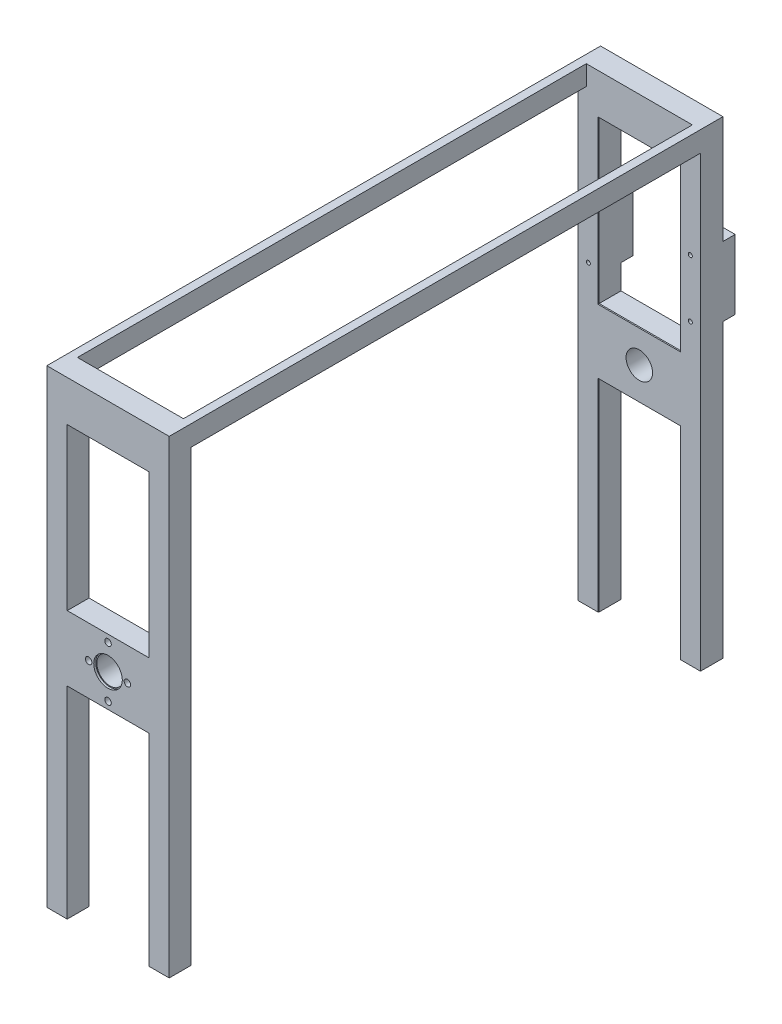
from build123d import *

# Parameters (mm, degrees)
BOSS_EXTRUDE1_START      = -8
SKETCH1_W                = 60
SKETCH1_H                = 230
BOSS_EXTRUDE1_DEPTH      = 11
CUT_EXTRUDE1_DEPTH       = 120.117588961
CUT_EXTRUDE1_DEPTH_BACK  = 120.117588961
SKETCH2_W                = 40
SKETCH2_H                = 99
CUT_EXTRUDE2_DEPTH       = 120.117588961
CUT_EXTRUDE2_DEPTH_BACK  = 120.117588961
SKETCH3_W                = 40
SKETCH3_H                = 79
SKETCH4_W                = 60
SKETCH4_H                = 230
BOSS_EXTRUDE3_DEPTH      = 11
CUT_EXTRUDE3_DEPTH       = 297.373497466
CUT_EXTRUDE3_DEPTH_BACK  = 297.373497466
SKETCH6_W                = 40
SKETCH6_H                = 79
CUT_EXTRUDE4_DEPTH       = 287.33066549
CUT_EXTRUDE4_DEPTH_BACK  = 287.33066549
SKETCH7_W                = 40
SKETCH7_H                = 99
SKETCH8_W                = 4
SKETCH8_H                = 10
BOSS_EXTRUDE4_DEPTH      = 249.5
CUT_EXTRUDE13_DEPTH      = 287.33066549
CUT_EXTRUDE13_DEPTH_BACK = 287.33066549
SKETCH9_R                = 6.5
CUT_EXTRUDE15_START      = -10
SKETCH13_R               = 7
CUT_EXTRUDE15_DEPTH      = 1
SKETCH14_R               = 7
CUT_EXTRUDE16_DEPTH      = 1
CUT_EXTRUDE17_REACH      = 298.373
SKETCH15_R               = 1.6
SKETCH17_W               = 10
SKETCH17_H               = 34
BOSS_EXTRUDE5_DEPTH      = 6
CUT_EXTRUDE18_REACH      = 303.88
SKETCH18_R               = 1
CHAMFER1_SIZE            = 0.3
CHAMFER2_SIZE            = 0.3
CHAMFER3_SIZE            = 0.3
CHAMFER4_SIZE            = 0.3
CHAMFER5_SIZE            = 0.3


with BuildPart() as part:
    # Sketch1 → Boss-Extrude1 (new body)
    with BuildSketch(Plane.XY.offset(BOSS_EXTRUDE1_START)):
        Rectangle(SKETCH1_W, SKETCH1_H)
    extrude(amount=BOSS_EXTRUDE1_DEPTH)

    # Sketch2 → Cut-Extrude1 (cut, two sides: drawn at the far end of the back side and taken through both)
    with BuildSketch(Plane.XY.offset(-CUT_EXTRUDE1_DEPTH_BACK)):
        with Locations((0, -65.5)):
            Rectangle(SKETCH2_W, SKETCH2_H)
    extrude(amount=CUT_EXTRUDE1_DEPTH + CUT_EXTRUDE1_DEPTH_BACK, mode=Mode.SUBTRACT)

    # Sketch3 → Cut-Extrude2 (cut, two sides: drawn at the far end of the back side and taken through both)
    with BuildSketch(Plane.XY.offset(-CUT_EXTRUDE2_DEPTH_BACK)):
        with Locations((0, 55.5)):
            Rectangle(SKETCH3_W, SKETCH3_H)
    extrude(amount=CUT_EXTRUDE2_DEPTH + CUT_EXTRUDE2_DEPTH_BACK, mode=Mode.SUBTRACT)



with BuildPart() as body_2:
    # Sketch4 → Boss-Extrude3 (new body)
    with BuildSketch(Plane.XY.offset(252.5)):
        Rectangle(SKETCH4_W, SKETCH4_H)
    extrude(amount=BOSS_EXTRUDE3_DEPTH)

    # Sketch6 → Cut-Extrude3 (cut, two sides: drawn at the far end of the back side and taken through both)
    with BuildSketch(Plane.XY.offset(263.5).offset(-CUT_EXTRUDE3_DEPTH_BACK)):
        with Locations((0, 55.5)):
            Rectangle(SKETCH6_W, SKETCH6_H)
    extrude(amount=CUT_EXTRUDE3_DEPTH + CUT_EXTRUDE3_DEPTH_BACK, mode=Mode.SUBTRACT)

    # Sketch7 → Cut-Extrude4 (cut, two sides: drawn at the far end of the back side and taken through both)
    with BuildSketch(Plane.XY.offset(252.5).offset(-CUT_EXTRUDE4_DEPTH_BACK)):
        with Locations((0, -65.5)):
            Rectangle(SKETCH7_W, SKETCH7_H)
    extrude(amount=CUT_EXTRUDE4_DEPTH + CUT_EXTRUDE4_DEPTH_BACK, mode=Mode.SUBTRACT)


with BuildPart() as part_1:
    add(part.part)

    add(body_2.part)  # Boss-Extrude4 merges body 2
    # Sketch8 → Boss-Extrude4 (add)
    with BuildSketch(Plane.XY.offset(3)):
        with Locations((-28, 110)):
            Rectangle(SKETCH8_W, SKETCH8_H)
        with Locations((28, 110)):
            Rectangle(SKETCH8_W, SKETCH8_H)
    extrude(amount=BOSS_EXTRUDE4_DEPTH)

    # Sketch9 → Cut-Extrude13 (cut, two sides: drawn at the far end of the back side and taken through both)
    with BuildSketch(Plane.XY.offset(252.5).offset(-CUT_EXTRUDE13_DEPTH_BACK)):
        with Locations(Location((0, 0, 0), (0, 0, 180))):
            Circle(SKETCH9_R)
    extrude(amount=CUT_EXTRUDE13_DEPTH + CUT_EXTRUDE13_DEPTH_BACK, mode=Mode.SUBTRACT)

    # Sketch13 → Cut-Extrude15 (cut)
    with BuildSketch(Plane(origin=(0, 0, 252.5), x_dir=(-1, 0, 0), z_dir=(0, 0, -1)).offset(CUT_EXTRUDE15_START)):
        Circle(SKETCH13_R)
    extrude(amount=-CUT_EXTRUDE15_DEPTH, mode=Mode.SUBTRACT)

    # Sketch14 → Cut-Extrude16 (cut)
    with BuildSketch(Plane(origin=(0, 0, -8), x_dir=(-1, 0, 0), z_dir=(0, 0, -1))):
        Circle(SKETCH14_R)
    extrude(amount=-CUT_EXTRUDE16_DEPTH, mode=Mode.SUBTRACT)

    # Sketch15 → Cut-Extrude17 (cut, up to next)
    with BuildSketch(Plane.XY.offset(263.5), mode=Mode.PRIVATE) as cut_extrude17_sk1:
        with Locations((9.5, 0)):
            Circle(SKETCH15_R)
    cut_extrude17_tool1 = extrude(cut_extrude17_sk1.sketch, amount=-CUT_EXTRUDE17_REACH, mode=Mode.PRIVATE) & part_1.part
    # Sketch15 → Cut-Extrude17 (cut, up to next)
    with BuildSketch(Plane.XY.offset(263.5), mode=Mode.PRIVATE) as cut_extrude17_sk2:
        with Locations(Location((-9.5, 0, 0), (0, 0, 180))):
            Circle(SKETCH15_R)
    cut_extrude17_tool2 = extrude(cut_extrude17_sk2.sketch, amount=-CUT_EXTRUDE17_REACH, mode=Mode.PRIVATE) & part_1.part
    # Sketch15 → Cut-Extrude17 (cut, up to next)
    with BuildSketch(Plane.XY.offset(263.5), mode=Mode.PRIVATE) as cut_extrude17_sk3:
        with Locations((0, 12.5)):
            Circle(SKETCH15_R)
    cut_extrude17_tool3 = extrude(cut_extrude17_sk3.sketch, amount=-CUT_EXTRUDE17_REACH, mode=Mode.PRIVATE) & part_1.part
    # Sketch15 → Cut-Extrude17 (cut, up to next)
    with BuildSketch(Plane.XY.offset(263.5), mode=Mode.PRIVATE) as cut_extrude17_sk4:
        with Locations(Location((0, -12.5, 0), (0, 0, 180))):
            Circle(SKETCH15_R)
    cut_extrude17_tool4 = extrude(cut_extrude17_sk4.sketch, amount=-CUT_EXTRUDE17_REACH, mode=Mode.PRIVATE) & part_1.part
    add(cut_extrude17_tool1.solids().sort_by_distance((9.5, 0, 263.5))[0], mode=Mode.SUBTRACT)
    add(cut_extrude17_tool2.solids().sort_by_distance((-9.5, 0, 263.5))[0], mode=Mode.SUBTRACT)
    add(cut_extrude17_tool3.solids().sort_by_distance((0, 12.5, 263.5))[0], mode=Mode.SUBTRACT)
    add(cut_extrude17_tool4.solids().sort_by_distance((0, -12.5, 263.5))[0], mode=Mode.SUBTRACT)

    # Sketch17 → Boss-Extrude5 (add)
    with BuildSketch(Plane(origin=(0, 0, -8), x_dir=(-1, 0, 0), z_dir=(0, 0, -1))):
        with Locations((25, 45)):
            Rectangle(SKETCH17_W, SKETCH17_H)
        with Locations((-25, 45)):
            Rectangle(SKETCH17_W, SKETCH17_H)
    extrude(amount=BOSS_EXTRUDE5_DEPTH)

    # Sketch18 → Cut-Extrude18 (cut, up to next)
    with BuildSketch(Plane(origin=(0, 0, -14), x_dir=(-1, 0, 0), z_dir=(0, 0, -1)), mode=Mode.PRIVATE) as cut_extrude18_sk1:
        with Locations((-25, 59.2)):
            Circle(SKETCH18_R)
    cut_extrude18_tool1 = extrude(cut_extrude18_sk1.sketch, amount=-CUT_EXTRUDE18_REACH, mode=Mode.PRIVATE) & part_1.part
    # Sketch18 → Cut-Extrude18 (cut, up to next)
    with BuildSketch(Plane(origin=(0, 0, -14), x_dir=(-1, 0, 0), z_dir=(0, 0, -1)), mode=Mode.PRIVATE) as cut_extrude18_sk2:
        with Locations((-25, 31)):
            Circle(SKETCH18_R)
    cut_extrude18_tool2 = extrude(cut_extrude18_sk2.sketch, amount=-CUT_EXTRUDE18_REACH, mode=Mode.PRIVATE) & part_1.part
    # Sketch18 → Cut-Extrude18 (cut, up to next)
    with BuildSketch(Plane(origin=(0, 0, -14), x_dir=(-1, 0, 0), z_dir=(0, 0, -1)), mode=Mode.PRIVATE) as cut_extrude18_sk3:
        with Locations((25, 59.2)):
            Circle(SKETCH18_R)
    cut_extrude18_tool3 = extrude(cut_extrude18_sk3.sketch, amount=-CUT_EXTRUDE18_REACH, mode=Mode.PRIVATE) & part_1.part
    # Sketch18 → Cut-Extrude18 (cut, up to next)
    with BuildSketch(Plane(origin=(0, 0, -14), x_dir=(-1, 0, 0), z_dir=(0, 0, -1)), mode=Mode.PRIVATE) as cut_extrude18_sk4:
        with Locations((25, 31)):
            Circle(SKETCH18_R)
    cut_extrude18_tool4 = extrude(cut_extrude18_sk4.sketch, amount=-CUT_EXTRUDE18_REACH, mode=Mode.PRIVATE) & part_1.part
    add(cut_extrude18_tool1.solids().sort_by_distance((25, 59.2, -14))[0], mode=Mode.SUBTRACT)
    add(cut_extrude18_tool2.solids().sort_by_distance((25, 31, -14))[0], mode=Mode.SUBTRACT)
    add(cut_extrude18_tool3.solids().sort_by_distance((-25, 59.2, -14))[0], mode=Mode.SUBTRACT)
    add(cut_extrude18_tool4.solids().sort_by_distance((-25, 31, -14))[0], mode=Mode.SUBTRACT)

    # Chamfer1
    chamfer1_edges = [part_1.edges().sort_by_distance(p)[0] for p in [
        (-30, -5, 252.5),
    ]]
    chamfer(chamfer1_edges, length=CHAMFER1_SIZE)

    # Chamfer2
    chamfer2_edges = [part_1.edges().sort_by_distance(p)[0] for p in [
        (30, -5, 252.5),
    ]]
    chamfer(chamfer2_edges, length=CHAMFER2_SIZE)

    # Chamfer3
    chamfer3_edges = [part_1.edges().sort_by_distance(p)[0] for p in [
        (-26, 105, 127.75),
        (26, 105, 127.75),
    ]]
    chamfer(chamfer3_edges, length=CHAMFER3_SIZE)

    # Chamfer4
    chamfer4_edges = [part_1.edges().sort_by_distance(p)[0] for p in [
        (-20, -65.5, 3),
        (20, -65.5, 3),
        (0, -16, 3),
        (20, 55.5, 3),
        (0, 95, 3),
        (-20, 55.5, 3),
        (0, 16, 3),
    ]]
    chamfer(chamfer4_edges, length=CHAMFER4_SIZE)

    # Chamfer5
    chamfer5_edges = [part_1.edges().sort_by_distance(p)[0] for p in [
        (20, -65.5, 252.5),
        (0, -16, 252.5),
        (-20, -65.5, 252.5),
        (20, 55.5, 252.5),
        (0, 16, 252.5),
        (-20, 55.5, 252.5),
        (0, 95, 252.5),
    ]]
    chamfer(chamfer5_edges, length=CHAMFER5_SIZE)


solid = part_1.part
